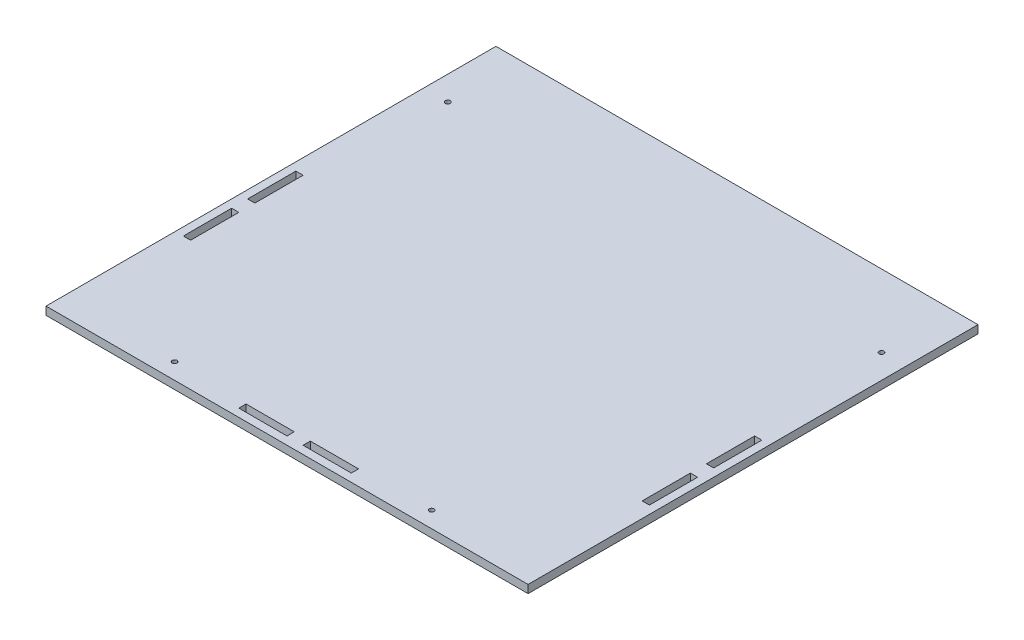
from build123d import *

# Parameters (mm, degrees)
SKETCH1_W           = 300
SKETCH1_H           = 280
SKETCH1_R           = 1.5
SKETCH1_W_2         = 30
SKETCH1_H_2         = 4.5
SKETCH1_W_3         = 4.5
SKETCH1_H_3         = 30
BOSS_EXTRUDE1_DEPTH = 5


with BuildPart() as part:
    # Sketch1 → Boss-Extrude1 (new body)
    with BuildSketch(Plane(origin=(0, 0, 0), x_dir=(1, 0, 0), z_dir=(0, 1, 0))):
        Rectangle(SKETCH1_W, SKETCH1_H)
        with Locations(Location((-134.97, 95, 0), (0, 0, 270))):
            Circle(SKETCH1_R, mode=Mode.SUBTRACT)
        with Locations(Location((134.97, 95, 0), (0, 0, 90))):
            Circle(SKETCH1_R, mode=Mode.SUBTRACT)
        with Locations(Location((80, -130, 0), (0, 0, 270))):
            Circle(SKETCH1_R, mode=Mode.SUBTRACT)
        with Locations(Location((-80, -130, 0), (0, 0, 90))):
            Circle(SKETCH1_R, mode=Mode.SUBTRACT)
        with Locations((-20, -132.75)):
            Rectangle(SKETCH1_W_2, SKETCH1_H_2, mode=Mode.SUBTRACT)
        with Locations((20, -132.75)):
            Rectangle(SKETCH1_W_2, SKETCH1_H_2, mode=Mode.SUBTRACT)
        with Locations((142.75, -44.5)):
            Rectangle(SKETCH1_W_3, SKETCH1_H_3, mode=Mode.SUBTRACT)
        with Locations((142.75, -4.5)):
            Rectangle(SKETCH1_W_3, SKETCH1_H_3, mode=Mode.SUBTRACT)
        with Locations((-142.75, -44.5)):
            Rectangle(SKETCH1_W_3, SKETCH1_H_3, mode=Mode.SUBTRACT)
        with Locations((-142.75, -4.5)):
            Rectangle(SKETCH1_W_3, SKETCH1_H_3, mode=Mode.SUBTRACT)
    extrude(amount=BOSS_EXTRUDE1_DEPTH)


solid = part.part
